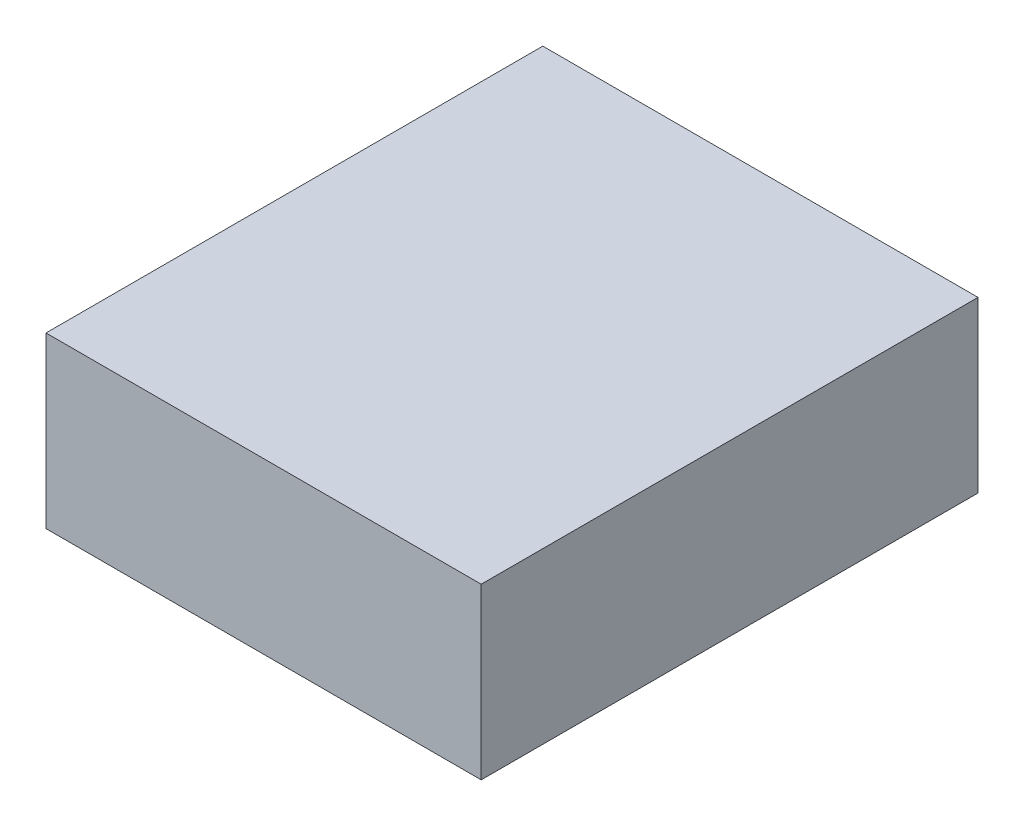
from build123d import *

# Parameters (mm, degrees)
CROQUIS1_W              = 56.5
CROQUIS1_H              = 64.5
SALIENTE_EXTRUIR1_DEPTH = 22


with BuildPart() as part:
    # Croquis1 → Saliente-Extruir1 (new body)
    with BuildSketch(Plane(origin=(0, 0, 0), x_dir=(1, 0, 0), z_dir=(0, 1, 0))):
        Rectangle(CROQUIS1_W, CROQUIS1_H)
    extrude(amount=SALIENTE_EXTRUIR1_DEPTH)


solid = part.part
